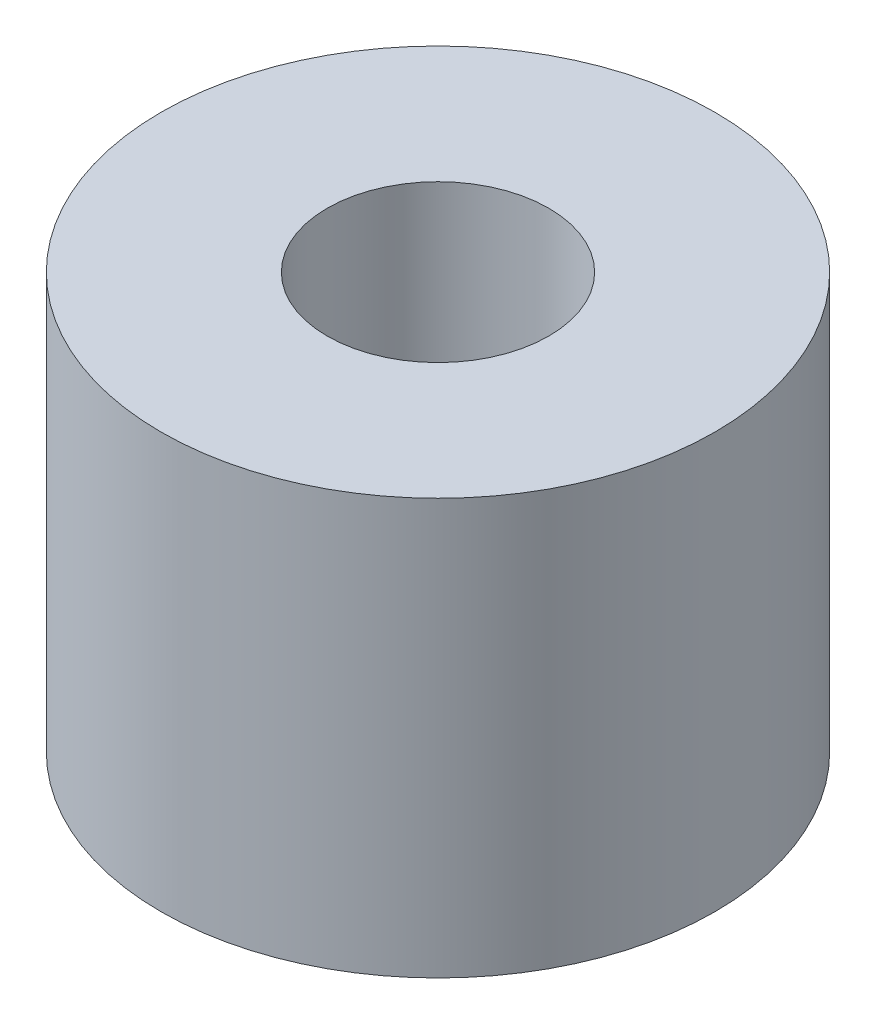
from build123d import *

# Parameters (mm, degrees)
SKETCH_1_R          = 10
EXTRUDE_1_DEPTH     = 15
SKETCH_2_R          = 4
CUT_EXTRUDE_1_DEPTH = 15


with BuildPart() as part:
    # 草图1 → 凸台-拉伸1 (new body)
    with BuildSketch(Plane(origin=(0, 0, 0), x_dir=(1, 0, 0), z_dir=(0, 1, 0))):
        with Locations(Location((0, 0, 0), (0, 0, 270))):
            Circle(SKETCH_1_R)
    extrude(amount=EXTRUDE_1_DEPTH)

    # 草图2 → 切除-拉伸1 (cut)
    with BuildSketch(Plane(origin=(0, 0, 0), x_dir=(1, 0, 0), z_dir=(0, 1, 0))):
        with Locations(Location((0, 0, 0), (0, 0, 270))):
            Circle(SKETCH_2_R)
    extrude(amount=CUT_EXTRUDE_1_DEPTH, mode=Mode.SUBTRACT)


solid = part.part
